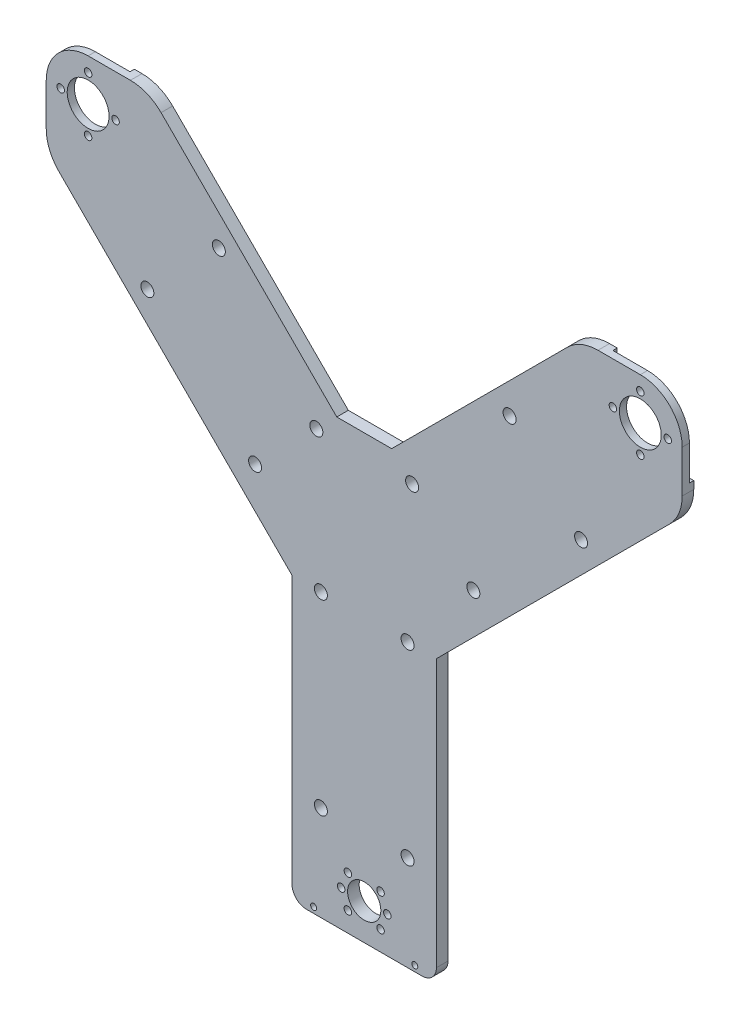
from build123d import *

# Parameters (mm, degrees)
ESQUISSE1_R               = 29
BOSS_EXTRU_1_DEPTH        = 4
ENL_V_START               = -6
ENL_V_MAT_EXTRU_1_DEPTH   = 6
BOSS_EXTRU_3_START        = 4
BOSS_EXTRU_3_DEPTH        = 4
ESQUISSE8_R               = 11
ESQUISSE8_R_2             = 14
ENL_V_MAT_EXTRU_2_DEPTH   = 12
ESQUISSE9_R               = 2.5
ENL_V_MAT_EXTRU_3_DEPTH   = 20
ESQUISSE10_R              = 2.5
ENL_V_MAT_EXTRU_4_DEPTH   = 12
ESQUISSE11_R              = 4.5
ENL_V_MAT_EXTRU_5_DEPTH   = 14
TROU_TARAUD_M5X0_81_D     = 4.2
TROU_TARAUD_M5X0_81_DEPTH = 14
TROU_TARAUD_M5X0_81_TIP   = 1.2618073
ESQUISSE14_R              = 2.5
ESQUISSE14_R_2            = 11
BOSS_EXTRU_4_DEPTH        = 4
BOSS_EXTRU_5_START        = 1
ESQUISSE15_R              = 2.5
ESQUISSE15_R_2            = 14
BOSS_EXTRU_5_DEPTH        = 1
ESQUISSE16_R              = 14.5
ESQUISSE16_R_2            = 14
ESQUISSE16_R_3            = 2.6
ESQUISSE16_R_4            = 2.5
ENL_V_MAT_EXTRU_6_DEPTH   = 10
ESQUISSE17_R              = 2.6
ESQUISSE17_R_2            = 2.5
ESQUISSE17_R_3            = 11.5
ESQUISSE17_R_4            = 11
ENL_V_MAT_EXTRU_7_DEPTH   = 10


with BuildPart() as part:
    # Esquisse1 → Boss.-Extru.1 (new body)
    with BuildSketch(Plane.XY):
        with BuildLine():
            Line((-40, -25), (40, -25))
            ThreePointArc((40, -25), (47.071067812, -22.071067812), (50, -15))
            Line((50, -15), (50, 170.289321881))
            Line((50, 170.289321881), (211.363203436, 331.652525317))
            ThreePointArc((211.363203436, 331.652525317), (217.866385975, 341.385225782), (220.15, 352.865728753))
            Line((220.15, 352.865728753), (220.15, 382.15))
            ThreePointArc((220.15, 382.15), (170.643903346, 361.643903346), (191.15, 411.15))
            Line((191.15, 411.15), (161.865728753, 411.15))
            ThreePointArc((161.865728753, 411.15), (150.385225782, 408.866385975), (140.652525317, 402.363203436))
            Line((140.652525317, 402.363203436), (19, 280.710678119))
            Line((19, 280.710678119), (-19, 280.710678119))
            Line((-19, 280.710678119), (-140.652525317, 402.363203436))
            ThreePointArc((-140.652525317, 402.363203436), (-150.385225782, 408.866385975), (-161.865728753, 411.15))
            Line((-161.865728753, 411.15), (-191.15, 411.15))
            ThreePointArc((-191.15, 411.15), (-170.643903346, 402.656096654), (-162.15, 382.15))
            ThreePointArc((-162.15, 382.15), (-191.15, 353.15), (-220.15, 382.15))
            Line((-220.15, 382.15), (-220.15, 352.865728753))
            ThreePointArc((-220.15, 352.865728753), (-217.866385975, 341.385225782), (-211.363203436, 331.652525317))
            Line((-211.363203436, 331.652525317), (-50, 170.289321881))
            Line((-50, 170.289321881), (-50, -15))
            ThreePointArc((-50, -15), (-47.071067812, -22.071067812), (-40, -25))
        make_face()
        with Locations((191.15, 382.15)):
            Circle(ESQUISSE1_R)
        with Locations((-191.15, 382.15)):
            Circle(ESQUISSE1_R)
    extrude(amount=-BOSS_EXTRU_1_DEPTH)

    # Esquisse4 → Enlèv. mat.-Extru.1 (cut)
    with BuildSketch(Plane(origin=(0, 0, -4), x_dir=(-1, 0, 0), z_dir=(0, 0, -1)).offset(ENL_V_START)):
        with BuildLine():
            Line((-14.875216904, -15), (14.875216904, -15))
            ThreePointArc((14.875216904, -15), (14.990842441, -14.97682257), (15.088601959, -14.910871568))
            ThreePointArc((15.088601959, -14.910871568), (21.213203436, 0), (15.088601959, 14.910871568))
            ThreePointArc((15.088601959, 14.910871568), (14.990842441, 14.97682257), (14.875216904, 15))
            Line((14.875216904, 15), (-14.875216904, 15))
            ThreePointArc((-14.875216904, 15), (-14.990842441, 14.97682257), (-15.088601959, 14.910871568))
            ThreePointArc((-15.088601959, 14.910871568), (-21.213203436, 0), (-15.088601959, -14.910871568))
            ThreePointArc((-15.088601959, -14.910871568), (-14.990842441, -14.97682257), (-14.875216904, -15))
        make_face()
        with BuildLine():
            Line((-191.15, 358.15), (-220.15, 358.15))
            Line((-220.15, 358.15), (-220.15, 382.15))
            ThreePointArc((-220.15, 382.15), (-211.656096654, 402.656096654), (-191.15, 411.15))
            Line((-191.15, 411.15), (-167.15, 411.15))
            Line((-167.15, 411.15), (-167.15, 382.15))
            ThreePointArc((-167.15, 382.15), (-174.179437252, 365.179437252), (-191.15, 358.15))
        make_face()
        with BuildLine():
            Line((191.15, 358.15), (220.15, 358.15))
            Line((220.15, 358.15), (220.15, 382.15))
            ThreePointArc((220.15, 382.15), (211.656096654, 402.656096654), (191.15, 411.15))
            Line((191.15, 411.15), (167.15, 411.15))
            Line((167.15, 411.15), (167.15, 382.15))
            ThreePointArc((167.15, 382.15), (174.179437252, 365.179437252), (191.15, 358.15))
        make_face()
    extrude(amount=ENL_V_MAT_EXTRU_1_DEPTH, mode=Mode.SUBTRACT)

    # Esquisse7 → Boss.-Extru.3 (add)
    with BuildSketch(Plane.XY.offset(BOSS_EXTRU_3_START)):
        with BuildLine():
            Line((220.15, 382.15), (220.15, 352.865728753))
            ThreePointArc((220.15, 352.865728753), (217.866385975, 341.385225782), (211.363203436, 331.652525317))
            Line((211.363203436, 331.652525317), (50, 170.289321881))
            Line((50, 170.289321881), (50, -15))
            ThreePointArc((50, -15), (47.071067812, -22.071067812), (40, -25))
            Line((40, -25), (-40, -25))
            ThreePointArc((-40, -25), (-47.071067812, -22.071067812), (-50, -15))
            Line((-50, -15), (-50, 170.289321881))
            Line((-50, 170.289321881), (-211.363203436, 331.652525317))
            ThreePointArc((-211.363203436, 331.652525317), (-217.866385975, 341.385225782), (-220.15, 352.865728753))
            Line((-220.15, 352.865728753), (-220.15, 382.15))
            ThreePointArc((-220.15, 382.15), (-211.656096654, 402.656096654), (-191.15, 411.15))
            Line((-191.15, 411.15), (-161.865728753, 411.15))
            ThreePointArc((-161.865728753, 411.15), (-150.385225782, 408.866385975), (-140.652525317, 402.363203436))
            Line((-140.652525317, 402.363203436), (-19, 280.710678119))
            Line((-19, 280.710678119), (19, 280.710678119))
            Line((19, 280.710678119), (140.652525317, 402.363203436))
            ThreePointArc((140.652525317, 402.363203436), (150.385225782, 408.866385975), (161.865728753, 411.15))
            Line((161.865728753, 411.15), (191.15, 411.15))
            ThreePointArc((191.15, 411.15), (211.656096654, 402.656096654), (220.15, 382.15))
        make_face()
    extrude(amount=-BOSS_EXTRU_3_DEPTH)

    # Esquisse8 → Enlèv. mat.-Extru.2 (cut)
    with BuildSketch(Plane(origin=(0, 0, -4), x_dir=(-1, 0, 0), z_dir=(0, 0, -1))):
        with Locations(Location((0, 0, 0), (0, 0, 180))):
            Circle(ESQUISSE8_R)
        with Locations(Location((191.15, 382.15, 0), (0, 0, 180))):
            Circle(ESQUISSE8_R_2)
        with Locations(Location((-191.15, 382.15, 0), (0, 0, 180))):
            Circle(ESQUISSE8_R_2)
    extrude(amount=-ENL_V_MAT_EXTRU_2_DEPTH, mode=Mode.SUBTRACT)

    # Esquisse9 → Enlèv. mat.-Extru.3 (cut)
    with BuildSketch(Plane(origin=(0, 0, -4), x_dir=(-1, 0, 0), z_dir=(0, 0, -1))):
        with Locations(Location((191.15, 401.15, 0), (0, 0, 180))):
            Circle(ESQUISSE9_R)
        with Locations(Location((210.15, 382.15, 0), (0, 0, 180))):
            Circle(ESQUISSE9_R)
        with Locations(Location((191.15, 363.15, 0), (0, 0, 180))):
            Circle(ESQUISSE9_R)
        with Locations(Location((172.15, 382.15, 0), (0, 0, 180))):
            Circle(ESQUISSE9_R)
        with Locations(Location((-191.15, 401.15, 0), (0, 0, 180))):
            Circle(ESQUISSE9_R)
        with Locations(Location((-172.15, 382.15, 0), (0, 0, 180))):
            Circle(ESQUISSE9_R)
        with Locations(Location((-191.15, 363.15, 0), (0, 0, 180))):
            Circle(ESQUISSE9_R)
        with Locations(Location((-210.15, 382.15, 0), (0, 0, 180))):
            Circle(ESQUISSE9_R)
    extrude(amount=-ENL_V_MAT_EXTRU_3_DEPTH, mode=Mode.SUBTRACT)

    # Esquisse10 → Enlèv. mat.-Extru.4 (cut)
    with BuildSketch(Plane(origin=(0, 0, -4), x_dir=(-1, 0, 0), z_dir=(0, 0, -1))):
        with Locations(Location((-11.313708499, -11.313708499, 0), (0, 0, 180))):
            Circle(ESQUISSE10_R)
        with Locations(Location((16, 0, 0), (0, 0, 180))):
            Circle(ESQUISSE10_R)
        with Locations(Location((11.313708499, 11.313708499, 0), (0, 0, 180))):
            Circle(ESQUISSE10_R)
        with Locations(Location((-16, 0, 0), (0, 0, 180))):
            Circle(ESQUISSE10_R)
        with Locations(Location((11.313708499, -11.313708499, 0), (0, 0, 180))):
            Circle(ESQUISSE10_R)
        with Locations(Location((-11.313708499, 11.313708499, 0), (0, 0, 180))):
            Circle(ESQUISSE10_R)
    extrude(amount=-ENL_V_MAT_EXTRU_4_DEPTH, mode=Mode.SUBTRACT)

    # Esquisse11 → Enlèv. mat.-Extru.5 (cut)
    with BuildSketch(Plane(origin=(0, 0, -4), x_dir=(-1, 0, 0), z_dir=(0, 0, -1))):
        with Locations((100.652525317, 341.15)):
            Circle(ESQUISSE11_R)
        with Locations((150.15, 291.652525317)):
            Circle(ESQUISSE11_R)
        with Locations((30, 40.85)):
            Circle(ESQUISSE11_R)
        with Locations((-30, 40.85)):
            Circle(ESQUISSE11_R)
        with Locations((75.568542495, 224.142135624)):
            Circle(ESQUISSE11_R)
        with Locations((30, 170.289321881)):
            Circle(ESQUISSE11_R)
        with Locations((-30, 170.289321881)):
            Circle(ESQUISSE11_R)
        with Locations((-75.568542495, 224.142135624)):
            Circle(ESQUISSE11_R)
        with Locations((-33.142135624, 266.568542495)):
            Circle(ESQUISSE11_R)
        with Locations((33.142135624, 266.568542495)):
            Circle(ESQUISSE11_R)
        with Locations((-150.15, 291.652525317)):
            Circle(ESQUISSE11_R)
        with Locations((-100.652525317, 341.15)):
            Circle(ESQUISSE11_R)
    extrude(amount=-ENL_V_MAT_EXTRU_5_DEPTH, mode=Mode.SUBTRACT)

    # Trou taraudé M5x0.81
    with Locations(Plane(origin=(0, 0, -4), x_dir=(-1, 0, 0), z_dir=(0, 0, -1))):
        with Locations((35, -21), (-35, -21)):
            Hole(TROU_TARAUD_M5X0_81_D / 2, depth=TROU_TARAUD_M5X0_81_DEPTH)
            with Locations((0, 0, -(TROU_TARAUD_M5X0_81_DEPTH + TROU_TARAUD_M5X0_81_TIP / 2))):  # 118° drill point
                Cone(0, TROU_TARAUD_M5X0_81_D / 2, TROU_TARAUD_M5X0_81_TIP, mode=Mode.SUBTRACT)

    # Esquisse14 → Boss.-Extru.4 (add)
    with BuildSketch(Plane(origin=(0, 0, 0), x_dir=(-1, 0, 0), z_dir=(0, 0, -1))):
        with BuildLine():
            Line((-14.875216904, -15), (14.875216904, -15))
            ThreePointArc((14.875216904, -15), (14.990842441, -14.97682257), (15.088601959, -14.910871568))
            ThreePointArc((15.088601959, -14.910871568), (21.213203436, 0), (15.088601959, 14.910871568))
            ThreePointArc((15.088601959, 14.910871568), (14.990842441, 14.97682257), (14.875216904, 15))
            Line((14.875216904, 15), (-14.875216904, 15))
            ThreePointArc((-14.875216904, 15), (-14.990842441, 14.97682257), (-15.088601959, 14.910871568))
            ThreePointArc((-15.088601959, 14.910871568), (-21.213203436, 0), (-15.088601959, -14.910871568))
            ThreePointArc((-15.088601959, -14.910871568), (-14.990842441, -14.97682257), (-14.875216904, -15))
        make_face()
        with Locations(Location((11.313708499, -11.313708499, 0), (0, 0, 180))):
            Circle(ESQUISSE14_R, mode=Mode.SUBTRACT)
        with Locations(Location((-11.313708499, -11.313708499, 0), (0, 0, 180))):
            Circle(ESQUISSE14_R, mode=Mode.SUBTRACT)
        with Locations(Location((-16, 0, 0), (0, 0, 180))):
            Circle(ESQUISSE14_R, mode=Mode.SUBTRACT)
        with Locations(Location((-11.313708499, 11.313708499, 0), (0, 0, 180))):
            Circle(ESQUISSE14_R, mode=Mode.SUBTRACT)
        with Locations(Location((11.313708499, 11.313708499, 0), (0, 0, 180))):
            Circle(ESQUISSE14_R, mode=Mode.SUBTRACT)
        with Locations(Location((16, 0, 0), (0, 0, 180))):
            Circle(ESQUISSE14_R, mode=Mode.SUBTRACT)
        with Locations(Location((0, 0, 0), (0, 0, 180))):
            Circle(ESQUISSE14_R_2, mode=Mode.SUBTRACT)
    extrude(amount=BOSS_EXTRU_4_DEPTH)

    # Esquisse15 → Boss.-Extru.5 (add)
    # profile 1 of 2: a face of its own
    with BuildSketch(Plane(origin=(0, 0, 0), x_dir=(-1, 0, 0), z_dir=(0, 0, -1)).offset(BOSS_EXTRU_5_START)):
        with BuildLine():
            Line((191.15, 411.15), (167.15, 411.15))
            Line((167.15, 411.15), (167.15, 382.15))
            ThreePointArc((167.15, 382.15), (174.179437252, 365.179437252), (191.15, 358.15))
            Line((191.15, 358.15), (220.15, 358.15))
            Line((220.15, 358.15), (220.15, 382.15))
            ThreePointArc((220.15, 382.15), (211.656096654, 402.656096654), (191.15, 411.15))
        make_face()
        with Locations((172.15, 382.15)):
            Circle(ESQUISSE15_R, mode=Mode.SUBTRACT)
        with Locations((210.15, 382.15)):
            Circle(ESQUISSE15_R, mode=Mode.SUBTRACT)
        with Locations((191.15, 363.15)):
            Circle(ESQUISSE15_R, mode=Mode.SUBTRACT)
        with Locations((191.15, 401.15)):
            Circle(ESQUISSE15_R, mode=Mode.SUBTRACT)
        with Locations((191.15, 382.15)):
            Circle(ESQUISSE15_R_2, mode=Mode.SUBTRACT)
    # profile 2 of 2: a face of its own
    with BuildSketch(Plane(origin=(0, 0, 0), x_dir=(-1, 0, 0), z_dir=(0, 0, -1)).offset(BOSS_EXTRU_5_START)):
        with BuildLine():
            Line((-220.15, 382.15), (-220.15, 358.15))
            Line((-220.15, 358.15), (-191.15, 358.15))
            ThreePointArc((-191.15, 358.15), (-174.179437252, 365.179437252), (-167.15, 382.15))
            Line((-167.15, 382.15), (-167.15, 411.15))
            Line((-167.15, 411.15), (-191.15, 411.15))
            ThreePointArc((-191.15, 411.15), (-211.656096654, 402.656096654), (-220.15, 382.15))
        make_face()
        with Locations((-191.15, 401.15)):
            Circle(ESQUISSE15_R, mode=Mode.SUBTRACT)
        with Locations((-172.15, 382.15)):
            Circle(ESQUISSE15_R, mode=Mode.SUBTRACT)
        with Locations((-191.15, 363.15)):
            Circle(ESQUISSE15_R, mode=Mode.SUBTRACT)
        with Locations((-210.15, 382.15)):
            Circle(ESQUISSE15_R, mode=Mode.SUBTRACT)
        with Locations((-191.15, 382.15)):
            Circle(ESQUISSE15_R_2, mode=Mode.SUBTRACT)
    extrude(amount=-BOSS_EXTRU_5_DEPTH)

    # Esquisse16 → Enlèv. mat.-Extru.6 (cut)
    # profile 1 of 10: a face of its own
    with BuildSketch(Plane(origin=(0, 0, -1), x_dir=(-1, 0, 0), z_dir=(0, 0, -1))):
        with Locations((-191.15, 382.15)):
            Circle(ESQUISSE16_R)
        with Locations((-191.15, 382.15)):
            Circle(ESQUISSE16_R_2, mode=Mode.SUBTRACT)
    # profile 2 of 10: a face of its own
    with BuildSketch(Plane(origin=(0, 0, -1), x_dir=(-1, 0, 0), z_dir=(0, 0, -1))):
        with Locations((191.15, 382.15)):
            Circle(ESQUISSE16_R)
        with Locations((191.15, 382.15)):
            Circle(ESQUISSE16_R_2, mode=Mode.SUBTRACT)
    # profile 3 of 10: a face of its own
    with BuildSketch(Plane(origin=(0, 0, -1), x_dir=(-1, 0, 0), z_dir=(0, 0, -1))):
        with Locations((-191.15, 401.15)):
            Circle(ESQUISSE16_R_3)
        with Locations((-191.15, 401.15)):
            Circle(ESQUISSE16_R_4, mode=Mode.SUBTRACT)
    # profile 4 of 10: a face of its own
    with BuildSketch(Plane(origin=(0, 0, -1), x_dir=(-1, 0, 0), z_dir=(0, 0, -1))):
        with Locations((-172.15, 382.15)):
            Circle(ESQUISSE16_R_3)
        with Locations((-172.15, 382.15)):
            Circle(ESQUISSE16_R_4, mode=Mode.SUBTRACT)
    # profile 5 of 10: a face of its own
    with BuildSketch(Plane(origin=(0, 0, -1), x_dir=(-1, 0, 0), z_dir=(0, 0, -1))):
        with Locations((-210.15, 382.15)):
            Circle(ESQUISSE16_R_3)
        with Locations((-210.15, 382.15)):
            Circle(ESQUISSE16_R_4, mode=Mode.SUBTRACT)
    # profile 6 of 10: a face of its own
    with BuildSketch(Plane(origin=(0, 0, -1), x_dir=(-1, 0, 0), z_dir=(0, 0, -1))):
        with Locations((-191.15, 363.15)):
            Circle(ESQUISSE16_R_3)
        with Locations((-191.15, 363.15)):
            Circle(ESQUISSE16_R_4, mode=Mode.SUBTRACT)
    # profile 7 of 10: a face of its own
    with BuildSketch(Plane(origin=(0, 0, -1), x_dir=(-1, 0, 0), z_dir=(0, 0, -1))):
        with Locations((191.15, 401.15)):
            Circle(ESQUISSE16_R_3)
        with Locations((191.15, 401.15)):
            Circle(ESQUISSE16_R_4, mode=Mode.SUBTRACT)
    # profile 8 of 10: a face of its own
    with BuildSketch(Plane(origin=(0, 0, -1), x_dir=(-1, 0, 0), z_dir=(0, 0, -1))):
        with Locations((210.15, 382.15)):
            Circle(ESQUISSE16_R_3)
        with Locations((210.15, 382.15)):
            Circle(ESQUISSE16_R_4, mode=Mode.SUBTRACT)
    # profile 9 of 10: a face of its own
    with BuildSketch(Plane(origin=(0, 0, -1), x_dir=(-1, 0, 0), z_dir=(0, 0, -1))):
        with Locations((172.15, 382.15)):
            Circle(ESQUISSE16_R_3)
        with Locations((172.15, 382.15)):
            Circle(ESQUISSE16_R_4, mode=Mode.SUBTRACT)
    # profile 10 of 10: a face of its own
    with BuildSketch(Plane(origin=(0, 0, -1), x_dir=(-1, 0, 0), z_dir=(0, 0, -1))):
        with Locations((191.15, 363.15)):
            Circle(ESQUISSE16_R_3)
        with Locations((191.15, 363.15)):
            Circle(ESQUISSE16_R_4, mode=Mode.SUBTRACT)
    extrude(amount=-ENL_V_MAT_EXTRU_6_DEPTH, mode=Mode.SUBTRACT)

    # Esquisse17 → Enlèv. mat.-Extru.7 (cut)
    # profile 1 of 7: a face of its own
    with BuildSketch(Plane(origin=(0, 0, -4), x_dir=(-1, 0, 0), z_dir=(0, 0, -1))):
        with Locations((-11.313708499, 11.313708499)):
            Circle(ESQUISSE17_R)
        with Locations((-11.313708499, 11.313708499)):
            Circle(ESQUISSE17_R_2, mode=Mode.SUBTRACT)
    # profile 2 of 7: a face of its own
    with BuildSketch(Plane(origin=(0, 0, -4), x_dir=(-1, 0, 0), z_dir=(0, 0, -1))):
        with Locations((-16, 0)):
            Circle(ESQUISSE17_R)
        with Locations((-16, 0)):
            Circle(ESQUISSE17_R_2, mode=Mode.SUBTRACT)
    # profile 3 of 7: a face of its own
    with BuildSketch(Plane(origin=(0, 0, -4), x_dir=(-1, 0, 0), z_dir=(0, 0, -1))):
        with Locations((-11.313708499, -11.313708499)):
            Circle(ESQUISSE17_R)
        with Locations((-11.313708499, -11.313708499)):
            Circle(ESQUISSE17_R_2, mode=Mode.SUBTRACT)
    # profile 4 of 7: a face of its own
    with BuildSketch(Plane(origin=(0, 0, -4), x_dir=(-1, 0, 0), z_dir=(0, 0, -1))):
        with Locations((11.313708499, -11.313708499)):
            Circle(ESQUISSE17_R)
        with Locations((11.313708499, -11.313708499)):
            Circle(ESQUISSE17_R_2, mode=Mode.SUBTRACT)
    # profile 5 of 7: a face of its own
    with BuildSketch(Plane(origin=(0, 0, -4), x_dir=(-1, 0, 0), z_dir=(0, 0, -1))):
        with Locations((16, 0)):
            Circle(ESQUISSE17_R)
        with Locations((16, 0)):
            Circle(ESQUISSE17_R_2, mode=Mode.SUBTRACT)
    # profile 6 of 7: a face of its own
    with BuildSketch(Plane(origin=(0, 0, -4), x_dir=(-1, 0, 0), z_dir=(0, 0, -1))):
        with Locations((11.313708499, 11.313708499)):
            Circle(ESQUISSE17_R)
        with Locations((11.313708499, 11.313708499)):
            Circle(ESQUISSE17_R_2, mode=Mode.SUBTRACT)
    # profile 7 of 7: a face of its own
    with BuildSketch(Plane(origin=(0, 0, -4), x_dir=(-1, 0, 0), z_dir=(0, 0, -1))):
        Circle(ESQUISSE17_R_3)
        Circle(ESQUISSE17_R_4, mode=Mode.SUBTRACT)
    extrude(amount=-ENL_V_MAT_EXTRU_7_DEPTH, mode=Mode.SUBTRACT)


solid = part.part
